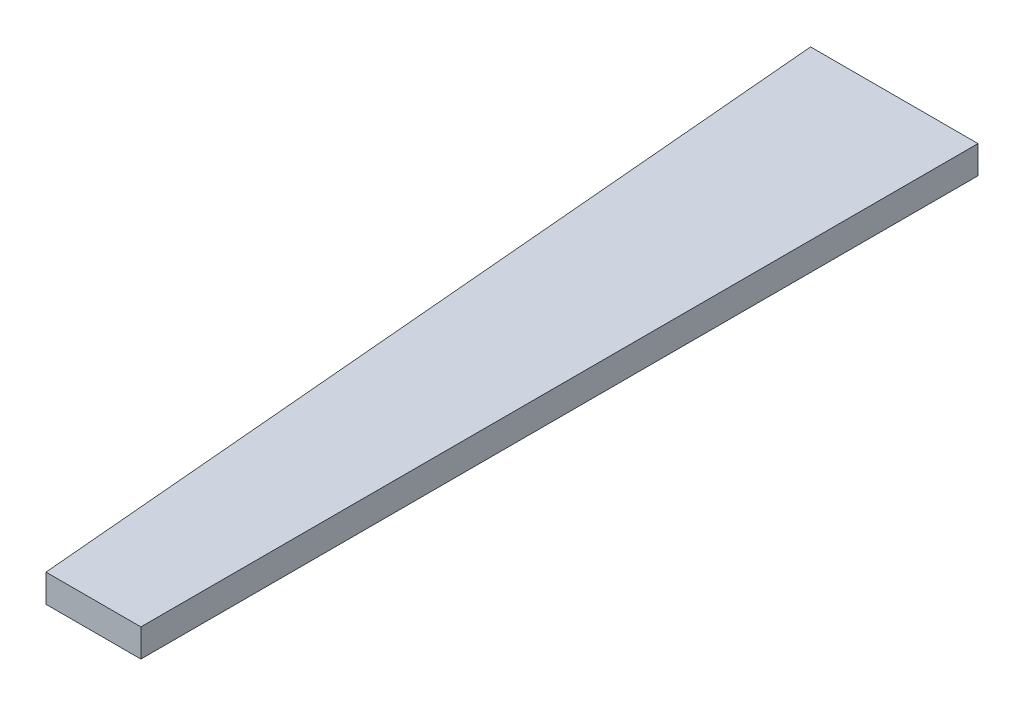
from build123d import *

# Parameters (mm, degrees)
BOSS_EXTRUDE1_DEPTH = 12.7


with BuildPart() as part:
    # Sketch1 → Boss-Extrude1 (new body)
    with BuildSketch(Plane(origin=(0, 0, 0), x_dir=(1, 0, 0), z_dir=(0, 1, 0))):
        Polygon((0, 0), (43.18, 0), (43.18, 381), (-33.02, 381), align=None)
    extrude(amount=BOSS_EXTRUDE1_DEPTH)


solid = part.part
